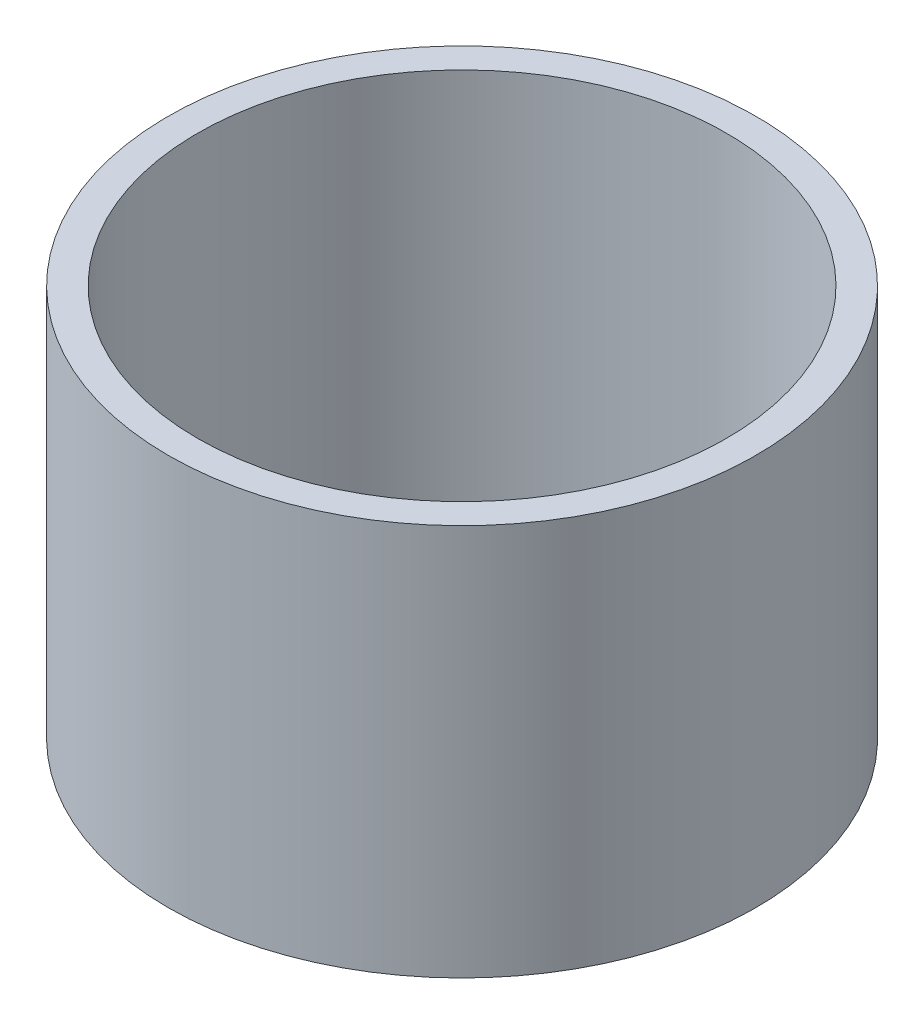
from build123d import *

# Parameters (mm, degrees)
SKETCH_1_R      = 15
SKETCH_1_R_2    = 13.5
EXTRUDE_1_DEPTH = 20


with BuildPart() as part:
    # 草图1 → 凸台-拉伸1 (new body)
    with BuildSketch(Plane(origin=(0, 0, 0), x_dir=(1, 0, 0), z_dir=(0, 1, 0))):
        with Locations(Location((0, 0, 0), (0, 0, 270))):
            Circle(SKETCH_1_R)
        with Locations(Location((0, 0, 0), (0, 0, 270))):
            Circle(SKETCH_1_R_2, mode=Mode.SUBTRACT)
    extrude(amount=EXTRUDE_1_DEPTH)


solid = part.part
